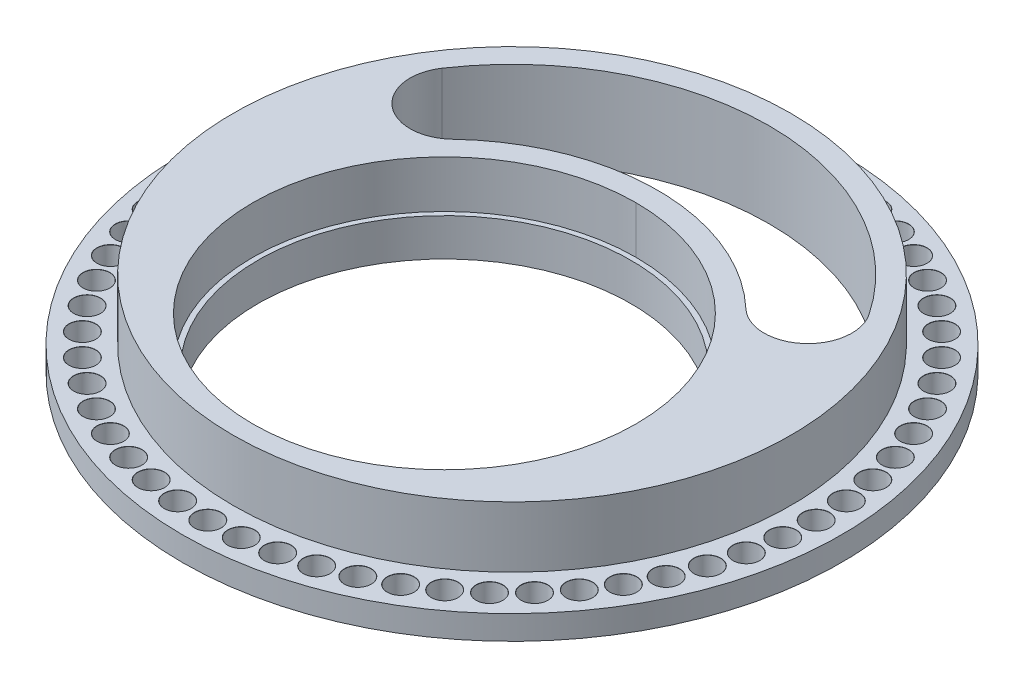
from build123d import *

# Parameters (mm, degrees)
SKETCH1_R                       = 61.9125
SKETCH1_R_2                     = 35.052
BOSS_EXTRUDE1_DEPTH             = 4.5212
SKETCH3_R                       = 52.3875
BOSS_EXTRUDE2_DEPTH             = 11.43
SKETCH4_R                       = 35.052
CUT_EXTRUDE1_DEPTH              = 89.998629731
SKETCH9_R                       = 36.000000009
CUT_EXTRUDE3_DEPTH              = 8.89
F_5_0MM_DOWEL_HOLE1_D           = 5
F_5_0MM_DOWEL_HOLE1_CSINK_D     = 5.05
F_5_0MM_DOWEL_HOLE1_CSINK_ANGLE = 90
CIRPATTERN1_COUNT               = 60
CUT_EXTRUDE5_DEPTH              = 89.998629731


with BuildPart() as part:
    # Sketch1 → Boss-Extrude1 (new body)
    with BuildSketch(Plane(origin=(0, 0, 0), x_dir=(1, 0, 0), z_dir=(0, 1, 0))):
        with Locations(Location((0, 0, 0), (0, 0, 270))):
            Circle(SKETCH1_R)
        with Locations(Location((0, -12.7, 0), (0, 0, 270))):
            Circle(SKETCH1_R_2, mode=Mode.SUBTRACT)
    extrude(amount=BOSS_EXTRUDE1_DEPTH)

    # Sketch3 → Boss-Extrude2 (add)
    with BuildSketch(Plane(origin=(0, 4.5212, 0), x_dir=(1, 0, 0), z_dir=(0, 1, 0))):
        with Locations(Location((0, 0, 0), (0, 0, 270))):
            Circle(SKETCH3_R)
    extrude(amount=BOSS_EXTRUDE2_DEPTH)

    # Sketch4 → Cut-Extrude1 (cut, through all)
    with BuildSketch(Plane.XZ):
        with Locations(Location((0, 12.7, 0), (0, 0, 270))):
            Circle(SKETCH4_R)
    extrude(amount=-CUT_EXTRUDE1_DEPTH, mode=Mode.SUBTRACT)

    # Sketch9 → Cut-Extrude3 (cut)
    with BuildSketch(Plane(origin=(0, 15.9512, 0), x_dir=(1, 0, 0), z_dir=(0, 1, 0))):
        with Locations(Location((0, -12.7, 0), (0, 0, 270))):
            Circle(SKETCH9_R)
    extrude(amount=-CUT_EXTRUDE3_DEPTH, mode=Mode.SUBTRACT)

    # Ø5.0mm Dowel Hole1 (through all)
    with Locations(Plane(origin=(0, 4.5212, 0), x_dir=(1, 0, 0), z_dir=(0, 1, 0))):
        with Locations((0, 57.15)):
            f_5_0mm_dowel_hole1 = CounterSinkHole(F_5_0MM_DOWEL_HOLE1_D / 2, F_5_0MM_DOWEL_HOLE1_CSINK_D / 2, counter_sink_angle=F_5_0MM_DOWEL_HOLE1_CSINK_ANGLE)

    # CirPattern1: Ø5.0mm Dowel Hole1 ×60 about axis
    cirpattern1_axis = Axis((0, 0, 0), (0, 1, 0))
    for i in range(1, CIRPATTERN1_COUNT):
        add(f_5_0mm_dowel_hole1.rotate(cirpattern1_axis, i * 360 / CIRPATTERN1_COUNT), mode=Mode.SUBTRACT)

    # Sketch10 → Cut-Extrude5 (cut, through all)
    with BuildSketch(Plane(origin=(0, 15.9512, 0), x_dir=(1, 0, 0), z_dir=(0, 1, 0))):
        with BuildLine():
            ThreePointArc((-27.568698422, 16.370448294), (0, 27.364000009), (27.568698422, 16.370448294))
            ThreePointArc((27.568698422, 16.370448294), (38.57955057, 16.056999754), (40.099152196, 26.966991775))
            ThreePointArc((40.099152196, 26.966991775), (0, 48.3235), (-40.099152196, 26.966991775))
            ThreePointArc((-40.099152196, 26.966991775), (-38.57955057, 16.056999754), (-27.568698422, 16.370448294))
        make_face()
    extrude(amount=-CUT_EXTRUDE5_DEPTH, mode=Mode.SUBTRACT)


solid = part.part
